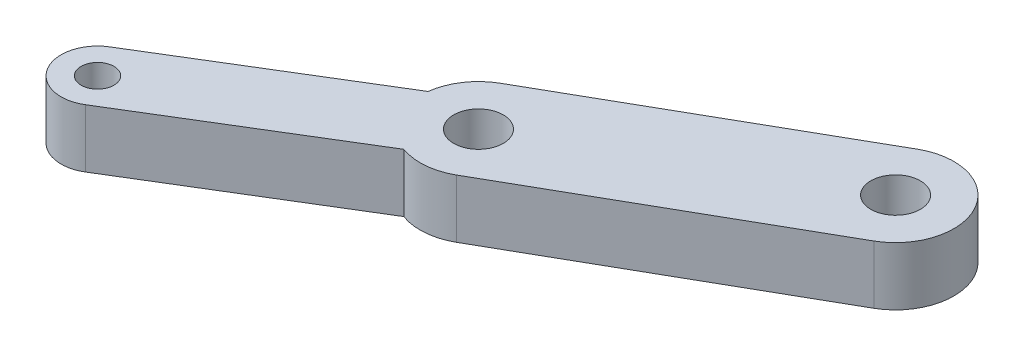
from build123d import *

# Parameters (mm, degrees)
SKETCH1_R           = 1.7
SKETCH1_R_2         = 1.125
BOSS_EXTRUDE1_DEPTH = 4


with BuildPart() as part:
    # Sketch1 → Boss-Extrude1 (new body)
    with BuildSketch(Plane(origin=(0, 0, 0), x_dir=(1, 0, 0), z_dir=(0, 1, 0))):
        with BuildLine():
            Line((-1.861032186, 5.671500837), (11.70980962, 13.943858026))
            ThreePointArc((11.70980962, 13.943858026), (11.793110745, 14.390229161), (11.926465203, 14.824283138))
            ThreePointArc((11.926465203, 14.824283138), (12.627588108, 16.022788534), (13.696191423, 16.909397504))
            Line((13.696191423, 16.909397504), (31.922238344, 27.299860881))
            ThreePointArc((31.922238344, 27.299860881), (37.378259624, 25.805929226), (35.88432797, 20.349907946))
            Line((35.88432797, 20.349907946), (17.658281049, 9.95944457))
            ThreePointArc((17.658281049, 9.95944457), (16.016619967, 9.448844707), (14.312262761, 9.674521117))
            Line((14.312262761, 9.674521117), (0.741420954, 1.402163927))
            ThreePointArc((0.741420954, 1.402163927), (-2.694474071, 2.235605811), (-1.861032186, 5.671500837))
        make_face()
        with Locations(Location((15.677236236, 13.434421037, 0), (0, 0, 270))):
            Circle(SKETCH1_R, mode=Mode.SUBTRACT)
        with Locations(Location((33.903283157, 23.824884413, 0), (0, 0, 270))):
            Circle(SKETCH1_R, mode=Mode.SUBTRACT)
        with Locations(Location((-0.559805616, 3.536832382, 0), (0, 0, 270))):
            Circle(SKETCH1_R_2, mode=Mode.SUBTRACT)
    extrude(amount=BOSS_EXTRUDE1_DEPTH)


solid = part.part
